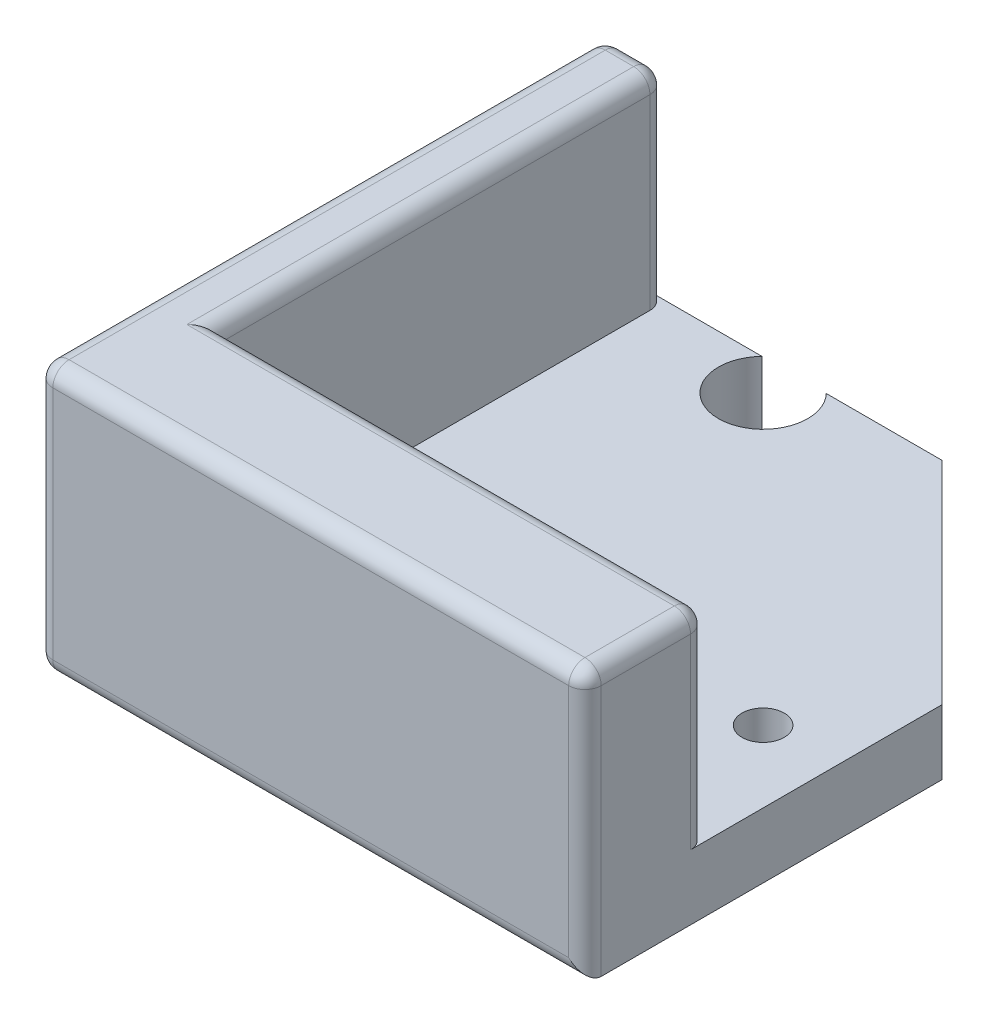
from build123d import *

# Parameters (mm, degrees)
BOSS_EXTRUDE1_DEPTH      = 2.54
SKETCH2_W                = 9.525
SKETCH2_H                = 38.1
BOSS_EXTRUDE2_DEPTH      = 15.875
BOSS_EXTRUDE3_DEPTH      = 5.08
M3_CLEARANCE_HOLE1_D     = 3.3
M3_CLEARANCE_HOLE1_DEPTH = 12.7
M3_CLEARANCE_HOLE1_TIP   = 0.991420021
SKETCH7_W                = 35.71875
SKETCH7_H                = 2.38125
CUT_EXTRUDE1_DEPTH       = 2.54
FILLET1_R                = 1.27
SKETCH8_R                = 3.4925
CUT_EXTRUDE2_DEPTH       = 10.16
CUT_EXTRUDE3_DEPTH       = 57.171484091
CUT_EXTRUDE3_DEPTH_BACK  = 57.171484091
SKETCH9_W                = 10.431111816
SKETCH9_H                = 47.706198334
FILLET3_R                = 1.27


with BuildPart() as part:
    # Sketch1 → Boss-Extrude1 (new body)
    with BuildSketch(Plane(origin=(0, 0, 0), x_dir=(1, 0, 0), z_dir=(0, 1, 0))):
        Polygon((0, 0), (38.1, 0), (38.1, 2.38125), (2.38125, 2.38125), (2.38125, 38.1), (0, 38.1), align=None)
    extrude(amount=BOSS_EXTRUDE1_DEPTH)

    # Sketch2 → Boss-Extrude2 (add)
    with BuildSketch(Plane(origin=(0, 2.54, 0), x_dir=(1, 0, 0), z_dir=(0, 1, 0))):
        with Locations((-4.7625, 19.05)):
            Rectangle(SKETCH2_W, SKETCH2_H)
        Polygon((0, 0), (-9.525, 0), (-9.525, -9.525), (38.1, -9.525), (38.1, 0), align=None)
    extrude(amount=-BOSS_EXTRUDE2_DEPTH)

    # Sketch3 → Boss-Extrude3 (add)
    with BuildSketch(Plane(origin=(0, -13.335, 0), x_dir=(-1, 0, 0), z_dir=(0, -1, 0))):
        Polygon((9.525, -9.525), (-38.1, -9.525), (-38.1, 18.373079092), (-18.373079092, 38.1), (9.525, 38.1), align=None)
    extrude(amount=BOSS_EXTRUDE3_DEPTH)

    # M3 Clearance Hole1
    with Locations(Plane(origin=(0, -18.415, 0), x_dir=(-1, 0, 0), z_dir=(0, -1, 0))):
        with Locations((-10, 32.5), (-32.5, 10)):
            Hole(M3_CLEARANCE_HOLE1_D / 2, depth=M3_CLEARANCE_HOLE1_DEPTH)
            with Locations((0, 0, -(M3_CLEARANCE_HOLE1_DEPTH + M3_CLEARANCE_HOLE1_TIP / 2))):  # 118° drill point
                Cone(0, M3_CLEARANCE_HOLE1_D / 2, M3_CLEARANCE_HOLE1_TIP, mode=Mode.SUBTRACT)

    # Sketch7 → Cut-Extrude1 (cut)
    with BuildSketch(Plane(origin=(0, 2.54, 0), x_dir=(1, 0, 0), z_dir=(0, 1, 0))):
        with Locations((20.240625, 1.190625)):
            Rectangle(SKETCH7_W, SKETCH7_H)
        Polygon((0, 0), (2.38125, 0), (2.38125, 2.38125), (2.38125, 38.1), (0, 38.1), align=None)
    extrude(amount=-CUT_EXTRUDE1_DEPTH, mode=Mode.SUBTRACT)

    # Fillet1
    fillet1_edges = [part.edges().sort_by_distance(p)[0] for p in [
        (38.1, 2.54, 4.7625),
        (0, -5.3975, -38.1),
        (-9.525, -7.9375, -38.1),
        (38.1, -5.3975, 0),
        (14.2875, 2.54, 9.525),
        (38.1, -7.9375, 9.525),
        (-9.525, -7.9375, 9.525),
        (-9.525, 2.54, -14.2875),
        (-9.525, -18.415, -14.2875),
        (14.2875, -18.415, 9.525),
        (-4.7625, 2.54, -38.1),
        (0, 2.54, -19.05),
        (19.05, 2.54, 0),
    ]]
    fillet(fillet1_edges, radius=FILLET1_R)

    # Sketch8 → Cut-Extrude2 (cut)
    with BuildSketch(Plane(origin=(0, -13.335, 0), x_dir=(1, 0, 0), z_dir=(0, 1, 0))):
        with Locations(Location((10, 32.5, 0), (0, 0, 270))):
            Circle(SKETCH8_R)
    extrude(amount=-CUT_EXTRUDE2_DEPTH, mode=Mode.SUBTRACT)

    # Sketch9 → Cut-Extrude3 (cut, two sides: drawn at the far end of the back side and taken through both)
    with BuildSketch(Plane(origin=(0, -13.335, 0), x_dir=(1, 0, 0), z_dir=(0, 1, 0)).offset(-CUT_EXTRUDE3_DEPTH_BACK)):
        with Locations((-9.978055908, 11.071900833)):
            Rectangle(SKETCH9_W, SKETCH9_H)
        Polygon((25.888370715, 34.925), (25.888370715, 38.1), (18.373079092, 38.1), (21.548079092, 34.925), align=None)
        with BuildLine():
            Line((21.548079092, 34.925), (18.373079092, 38.1))
            Line((18.373079092, 38.1), (-1.27, 38.1))
            ThreePointArc((-1.27, 38.1), (-0.371974388, 37.728025612), (0, 36.83))
            Line((0, 36.83), (0, 34.925))
            Line((0, 34.925), (7.486649398, 34.925))
            ThreePointArc((7.486649398, 34.925), (10, 35.9925), (12.513350602, 34.925))
            Line((12.513350602, 34.925), (21.548079092, 34.925))
        make_face()
        with BuildLine():
            ThreePointArc((0, 36.83), (-0.371974388, 37.728025612), (-1.27, 38.1))
            Line((-1.27, 38.1), (-15.193611816, 38.1))
            Line((-15.193611816, 38.1), (-15.193611816, 34.925))
            Line((-15.193611816, 34.925), (-4.7625, 34.925))
            Line((-4.7625, 34.925), (0, 34.925))
            Line((0, 34.925), (0, 36.83))
        make_face()
    extrude(amount=CUT_EXTRUDE3_DEPTH + CUT_EXTRUDE3_DEPTH_BACK, mode=Mode.SUBTRACT)

    # Fillet3
    fillet3_edges = [part.edges().sort_by_distance(p)[0] for p in [
        (-4.7625, 2.168025612, 9.153025612),
        (-4.7625, -7.9375, 9.525),
        (-0.371974388, 2.168025612, -34.925),
        (-3.01625, 2.54, -34.925),
        (-4.7625, -18.415, -13.335),
        (0, -6.0325, -34.925),
        (-4.7625, -18.043025612, 9.153025612),
        (-4.7625, -7.9375, -34.925),
        (-4.7625, 2.54, -13.335),
    ]]
    fillet(fillet3_edges, radius=FILLET3_R)


solid = part.part
